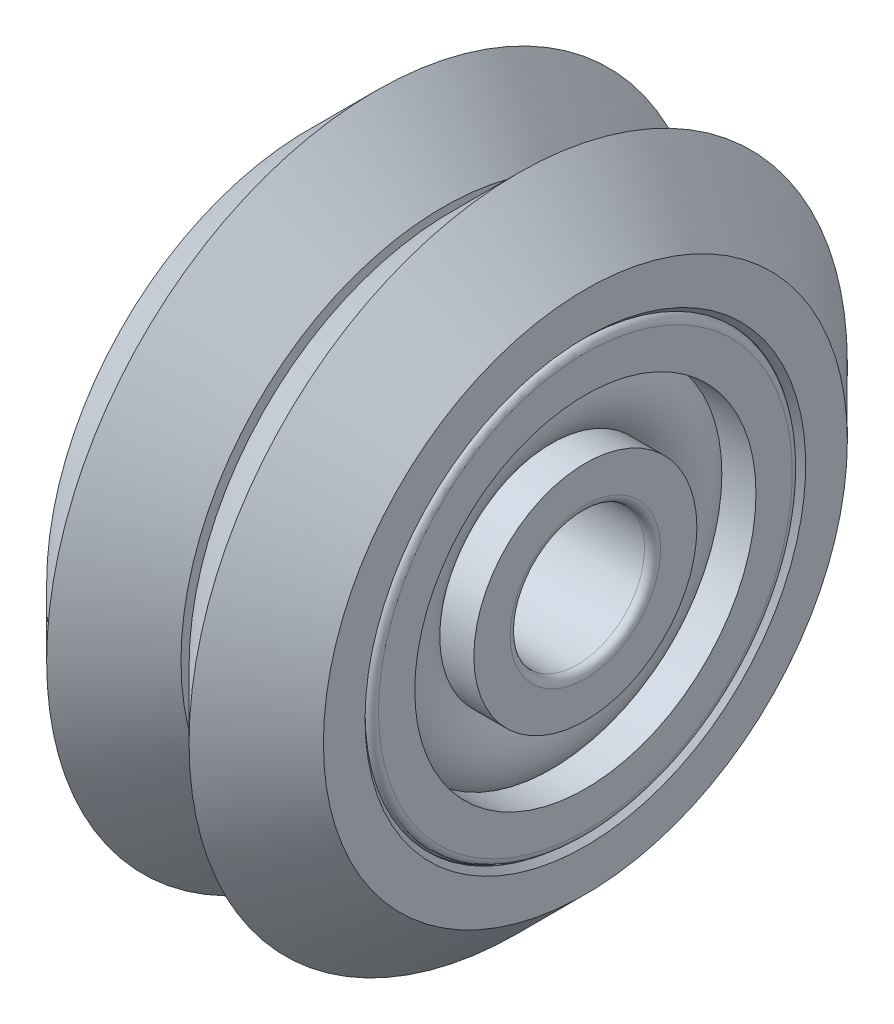
from build123d import *


with BuildPart() as part:
    # Sketch14 → Revolve4 (revolve)
    with BuildSketch(Plane(origin=(0, 0, 0), x_dir=(-1, 0, 0), z_dir=(0, 0, -1)), mode=Mode.PRIVATE) as revolve4_sk:
        with BuildLine():
            Line((-0.149999999, 2.8), (-0.149999999, 4.15))
            Line((-0.149999999, 4.15), (-1.420162613, 4.15))
            ThreePointArc((-1.420162613, 4.15), (-0.999999999, 5.250000001), (-1.420162612, 6.350000002))
            Line((-1.420162612, 6.350000002), (-0.149999999, 6.350000002))
            Line((-0.149999999, 6.350000002), (-0.149999999, 7.7))
            ThreePointArc((-0.149999999, 7.7), (-0.237867965, 7.912132034), (-0.45, 8))
            Line((-0.45, 8), (-4.85, 8))
            ThreePointArc((-4.85, 8), (-5.062132034, 7.912132034), (-5.15, 7.7))
            Line((-5.15, 7.7), (-5.15, 6.350000002))
            Line((-5.15, 6.350000002), (-3.879837388, 6.350000002))
            ThreePointArc((-3.879837388, 6.350000002), (-4.300000001, 5.250000001), (-3.879837387, 4.15))
            Line((-3.879837387, 4.15), (-5.15, 4.15))
            Line((-5.15, 4.15), (-5.15, 2.8))
            ThreePointArc((-5.15, 2.8), (-5.062132034, 2.587867966), (-4.849999999, 2.5))
            Line((-4.849999999, 2.5), (-0.449999999, 2.5))
            ThreePointArc((-0.449999999, 2.5), (-0.237867965, 2.587867966), (-0.149999999, 2.8))
        make_face()
    revolve(revolve4_sk.sketch.rotate(Axis((5.166936363, 0, 0), (-1, 0, 0)), 270), axis=Axis((5.166936363, 0, 0), (-1, 0, 0)))


with BuildPart() as body_2:
    # Sketch16 → Revolve5 (revolve)
    with BuildSketch(Plane.XY):
        with BuildLine():
            Line((-0.149999999, 2.8), (-0.149999999, 4.15))
            Line((-0.149999999, 4.15), (-1.420162613, 4.15))
            ThreePointArc((-1.420162613, 4.15), (-1, 5.25), (-1.420162612, 6.35))
            Line((-1.420162612, 6.35), (-0.149999999, 6.35))
            Line((-0.149999999, 6.35), (-0.149999999, 7.7))
            ThreePointArc((-0.149999999, 7.7), (-0.237867965, 7.912132035), (-0.449999999, 8))
            Line((-0.449999999, 8), (-4.849999999, 8))
            ThreePointArc((-4.849999999, 8), (-5.062132034, 7.912132035), (-5.15, 7.700000001))
            Line((-5.15, 7.700000001), (-5.15, 6.35))
            Line((-5.15, 6.35), (-3.879837388, 6.35))
            ThreePointArc((-3.879837388, 6.35), (-4.3, 5.25), (-3.879837387, 4.15))
            Line((-3.879837387, 4.15), (-5.15, 4.15))
            Line((-5.15, 4.15), (-5.15, 2.8))
            ThreePointArc((-5.15, 2.8), (-5.062132034, 2.587867966), (-4.85, 2.5))
            Line((-4.85, 2.5), (-0.45, 2.5))
            ThreePointArc((-0.45, 2.5), (-0.237867965, 2.587867965), (-0.149999999, 2.8))
        make_face()
    revolve(axis=Axis((-5.166936363, 0, 0), (1, 0, 0)))


with BuildPart() as body_3:
    # Sketch21 → Revolve6 (revolve)
    with BuildSketch(Plane(origin=(0, 0, 0), x_dir=(-1, 0, 0), z_dir=(0, 0, -1)), mode=Mode.PRIVATE) as revolve6_sk:
        Polygon((5.15, 8.2), (5.15, 9.75), (2.65, 12.25), (0.15, 9.75), (0.15, 9.25), (-0.15, 9.25), (-0.15, 9.75), (-2.65, 12.25), (-5.15, 9.75), (-5.15, 8.2), (-4.95, 8), (-0.15, 8), (-0.15, 6.8), (0.15, 6.8), (0.15, 8), (4.95, 8), align=None)
    revolve(revolve6_sk.sketch.rotate(Axis((5.15, 0, 0), (-1, 0, 0)), 270), axis=Axis((5.15, 0, 0), (-1, 0, 0)))


solid = Compound([part.part, body_2.part, body_3.part])
